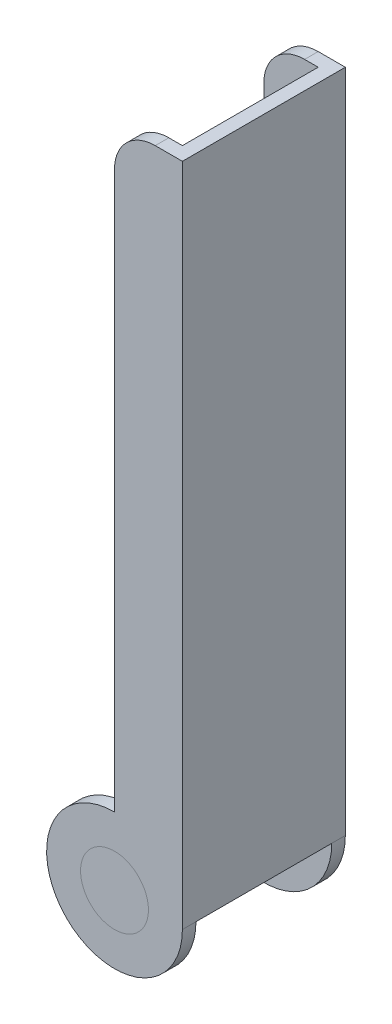
from build123d import *

# Parameters (mm, degrees)
BOSS_EXTRUDE1_DEPTH   = 12
SKETCH1_R             = 2.5
BOSS_EXTRUDE1_2_DEPTH = 12
SKETCH1_4_R           = 2.5
BOSS_EXTRUDE2_DEPTH   = 1
BOSS_EXTRUDE3_START   = 11
SKETCH1_5_R           = 2.5
BOSS_EXTRUDE3_DEPTH   = 1
FILLET1_R             = 3


with BuildPart() as part:
    # Sketch1 → Boss-Extrude1 (new body)
    with BuildSketch(Plane.XY):
        with BuildLine():
            ThreePointArc((4, 3), (4.74341649, 1.58113883), (5, 0))
            Line((5, 0), (5, 49))
            Line((5, 49), (4, 49))
            Line((4, 49), (4, 3))
        make_face()
    extrude(amount=BOSS_EXTRUDE1_DEPTH)

    # Sketch1<4> → Boss-Extrude2 (add)
    with BuildSketch(Plane.XY):
        with BuildLine():
            Line((4, 3), (4, 49))
            Line((4, 49), (0, 49))
            Line((0, 49), (0, 5))
            ThreePointArc((0, 5), (-2.236067977, -4.472135955), (4, 3))
        make_face()
        Circle(SKETCH1_4_R, mode=Mode.SUBTRACT)
    extrude(amount=BOSS_EXTRUDE2_DEPTH)

    # Sketch1<5> → Boss-Extrude3 (add)
    with BuildSketch(Plane.XY.offset(BOSS_EXTRUDE3_START)):
        with BuildLine():
            Line((4, 3), (4, 49))
            Line((4, 49), (0, 49))
            Line((0, 49), (0, 5))
            ThreePointArc((0, 5), (-2.236067977, -4.472135955), (4, 3))
        make_face()
        Circle(SKETCH1_5_R, mode=Mode.SUBTRACT)
    extrude(amount=BOSS_EXTRUDE3_DEPTH)

    # Fillet1
    fillet1_edges = [part.edges().sort_by_distance(p)[0] for p in [
        (0, 49, 11.5),
        (0, 49, 0.5),
    ]]
    fillet(fillet1_edges, radius=FILLET1_R)


with BuildPart() as body_2:
    # Sketch1 → Boss-Extrude1 2 (new body)
    with BuildSketch(Plane.XY):
        Circle(SKETCH1_R)
    extrude(amount=BOSS_EXTRUDE1_2_DEPTH)


solid = Compound([part.part, body_2.part])
